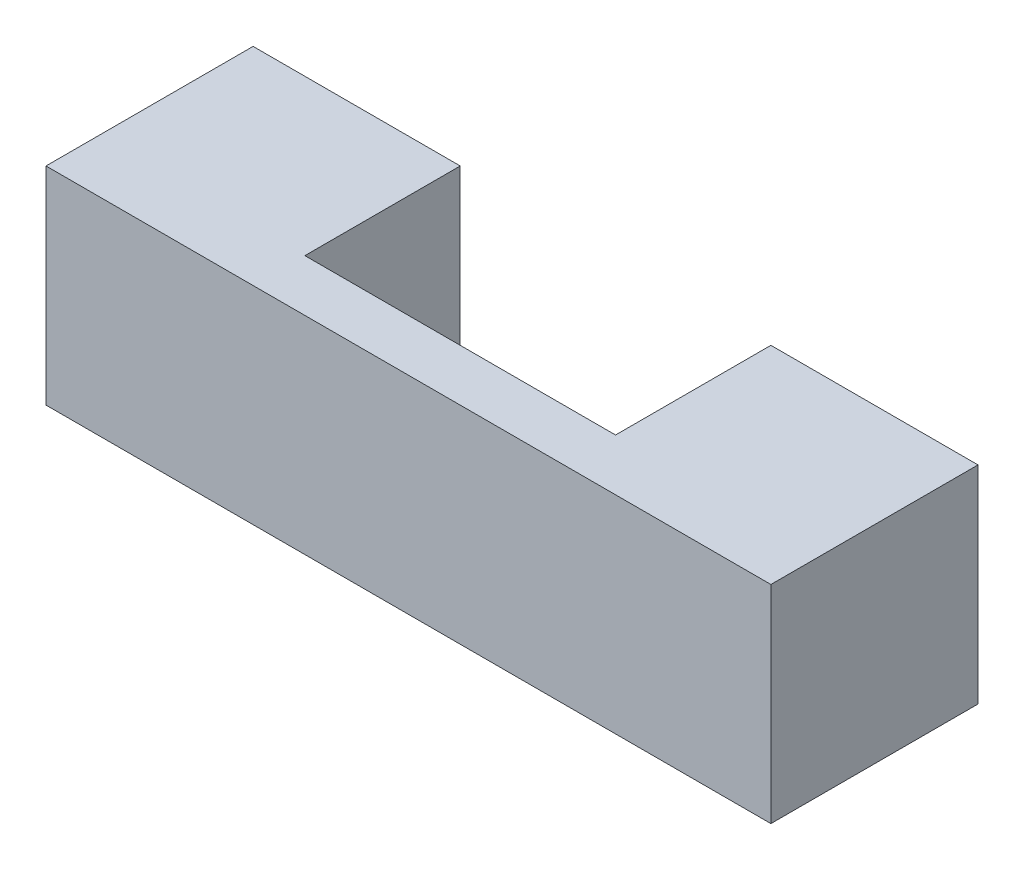
from build123d import *

# Parameters (mm, degrees)
SKETCH1_W           = 15
SKETCH1_H           = 4
BOSS_EXTRUDE1_DEPTH = 4.5
SKETCH2_W           = 6
SKETCH2_H           = 3
CUT_EXTRUDE1_DEPTH  = 4.5
SKETCH3_W           = 0.5
SKETCH3_H           = 4.5
CUT_EXTRUDE2_DEPTH  = 9.5
SKETCH4_W           = 0.5
SKETCH4_H           = 4.5
CUT_EXTRUDE3_DEPTH  = 9.5
SKETCH6_W           = 14
SKETCH6_H           = 0.5
CUT_EXTRUDE5_DEPTH  = 9.5


with BuildPart() as part:
    # Sketch1 → Boss-Extrude1 (new body)
    with BuildSketch(Plane(origin=(0, 0, 0), x_dir=(1, 0, 0), z_dir=(0, 1, 0))):
        with Locations((7.5, 2)):
            Rectangle(SKETCH1_W, SKETCH1_H)
    extrude(amount=BOSS_EXTRUDE1_DEPTH)

    # Sketch2 → Cut-Extrude1 (cut)
    with BuildSketch(Plane(origin=(0, 4.5, 0), x_dir=(1, 0, 0), z_dir=(0, 1, 0))):
        with Locations((7.5, 2.5)):
            Rectangle(SKETCH2_W, SKETCH2_H)
    extrude(amount=-CUT_EXTRUDE1_DEPTH, mode=Mode.SUBTRACT)

    # Sketch3 → Cut-Extrude2 (cut)
    with BuildSketch(Plane(origin=(0, 0, -4), x_dir=(-1, 0, 0), z_dir=(0, 0, -1))):
        with Locations((-0.25, 2.25)):
            Rectangle(SKETCH3_W, SKETCH3_H)
    extrude(amount=-CUT_EXTRUDE2_DEPTH, mode=Mode.SUBTRACT)

    # Sketch4 → Cut-Extrude3 (cut)
    with BuildSketch(Plane(origin=(0, 0, -4), x_dir=(-1, 0, 0), z_dir=(0, 0, -1))):
        with Locations((-14.75, 2.25)):
            Rectangle(SKETCH4_W, SKETCH4_H)
    extrude(amount=-CUT_EXTRUDE3_DEPTH, mode=Mode.SUBTRACT)

    # Sketch6 → Cut-Extrude5 (cut)
    with BuildSketch(Plane.XY):
        with Locations((7.5, 4.25)):
            Rectangle(SKETCH6_W, SKETCH6_H)
    extrude(amount=-CUT_EXTRUDE5_DEPTH, mode=Mode.SUBTRACT)


solid = part.part
